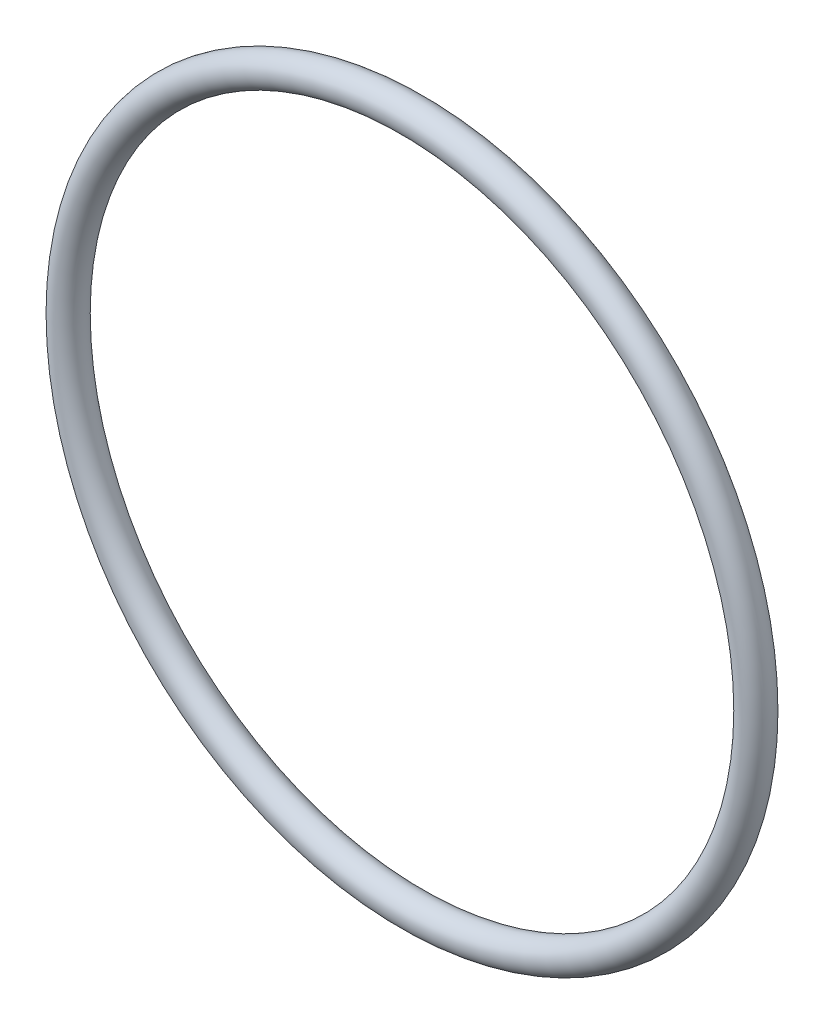
from build123d import *

# Parameters (mm, degrees)
ESQUISSE1_R = 1


with BuildPart() as part:
    # Esquisse1 → Révolution3 (revolve)
    with BuildSketch(Plane(origin=(0, 0, 0), x_dir=(0, 0, -1), z_dir=(1, 0, 0)), mode=Mode.PRIVATE) as r_volution3_sk:
        with Locations((0, -22)):
            Circle(ESQUISSE1_R)
    revolve(r_volution3_sk.sketch.rotate(Axis((0, 0, 13.392332391), (0, 0, -1)), 270), axis=Axis((0, 0, 13.392332391), (0, 0, -1)))


solid = part.part
